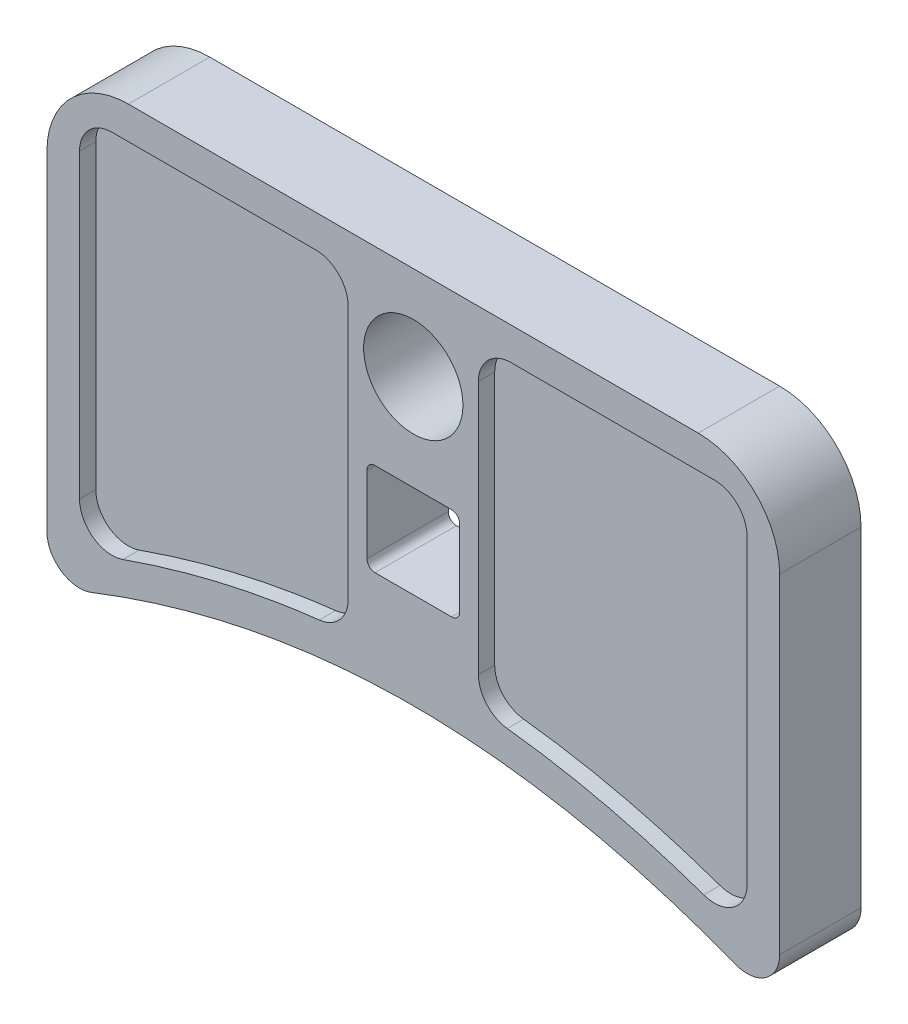
from build123d import *

# Parameters (mm, degrees)
BOSS_EXTRUDE1_DEPTH = 5
SKETCH2_R           = 3.05
SKETCH2_W           = 5.7
SKETCH2_H           = 5.7
CUT_EXTRUDE1_DEPTH  = 29.419018875
FILLET1_R           = 0.5
CUT_EXTRUDE2_DEPTH  = 1
FILLET2_R           = 5
FILLET3_R           = 2
FILLET4_R           = 2


with BuildPart() as part:
    # Sketch1 → Boss-Extrude1 (new body)
    with BuildSketch(Plane.XY):
        with BuildLine():
            Line((-22.5, -11.625), (-22.5, -16.625))
            add(Edge.make_bspline(
                [(-22.5, -16.625), (0, -6.625), (22.5, -16.625)],
                knots=[0, 0, 0, 1, 1, 1], degree=2))
            Line((22.5, -16.625), (22.5, -11.625))
            Line((22.5, -11.625), (22.5, 11.625))
            Line((22.5, 11.625), (-22.5, 11.625))
            Line((-22.5, 11.625), (-22.5, -11.625))
        make_face()
    extrude(amount=-BOSS_EXTRUDE1_DEPTH)

    # Sketch2 → Cut-Extrude1 (cut, through all)
    with BuildSketch(Plane.XY):
        with Locations((0, 5.875)):
            Circle(SKETCH2_R)
        with Locations((0, -2.875)):
            Rectangle(SKETCH2_W, SKETCH2_H)
    extrude(amount=-CUT_EXTRUDE1_DEPTH, mode=Mode.SUBTRACT)

    # Fillet1
    fillet1_edges = [part.edges().sort_by_distance(p)[0] for p in [
        (2.85, -0.025, -2.5),
        (2.85, -5.725, -2.5),
        (-2.85, -5.725, -2.5),
        (-2.85, -0.025, -2.5),
    ]]
    fillet(fillet1_edges, radius=FILLET1_R)

    # Sketch3 → Cut-Extrude2 (cut)
    with BuildSketch(Plane.XY):
        with BuildLine():
            Line((-20.5, 9.625), (-20.5, -13.775617284))
            add(Edge.make_bspline(
                [(-4, -9.783024691), (-9.5, -10.217592593), (-15, -11.54845679), (-20.5, -13.775617284)],
                knots=[0.588888889, 0.588888889, 0.588888889, 0.588888889, 0.955555556, 0.955555556, 0.955555556, 0.955555556], degree=3))
            Line((-4, -9.783024691), (-4, 9.625))
            Line((-4, 9.625), (-20.5, 9.625))
        make_face()
        with BuildLine():
            Line((4, 9.625), (4, -9.783024691))
            add(Edge.make_bspline(
                [(4, -9.783024691), (9.5, -10.217592593), (15, -11.54845679), (20.5, -13.775617284)],
                knots=[0.588888889, 0.588888889, 0.588888889, 0.588888889, 0.955555556, 0.955555556, 0.955555556, 0.955555556], degree=3))
            Line((20.5, -13.775617284), (20.5, 9.625))
            Line((20.5, 9.625), (4, 9.625))
        make_face()
    extrude(amount=-CUT_EXTRUDE2_DEPTH, mode=Mode.SUBTRACT)

    # Fillet2
    fillet2_edges = [part.edges().sort_by_distance(p)[0] for p in [
        (-22.5, 11.625, -2.5),
        (22.5, 11.625, -2.5),
    ]]
    fillet(fillet2_edges, radius=FILLET2_R)

    # Fillet3
    fillet3_edges = [part.edges().sort_by_distance(p)[0] for p in [
        (22.5, -16.625, -2.5),
        (-22.5, -16.625, -2.5),
    ]]
    fillet(fillet3_edges, radius=FILLET3_R)

    # Fillet4
    fillet4_edges = [part.edges().sort_by_distance(p)[0] for p in [
        (20.5, -13.775617284, -0.5),
        (4, -9.783024691, -0.5),
        (20.5, 9.625, -0.5),
        (4, 9.625, -0.5),
        (-4, 9.625, -0.5),
        (-20.5, 9.625, -0.5),
        (-4, -9.783024691, -0.5),
        (-20.5, -13.775617284, -0.5),
    ]]
    fillet(fillet4_edges, radius=FILLET4_R)


solid = part.part
